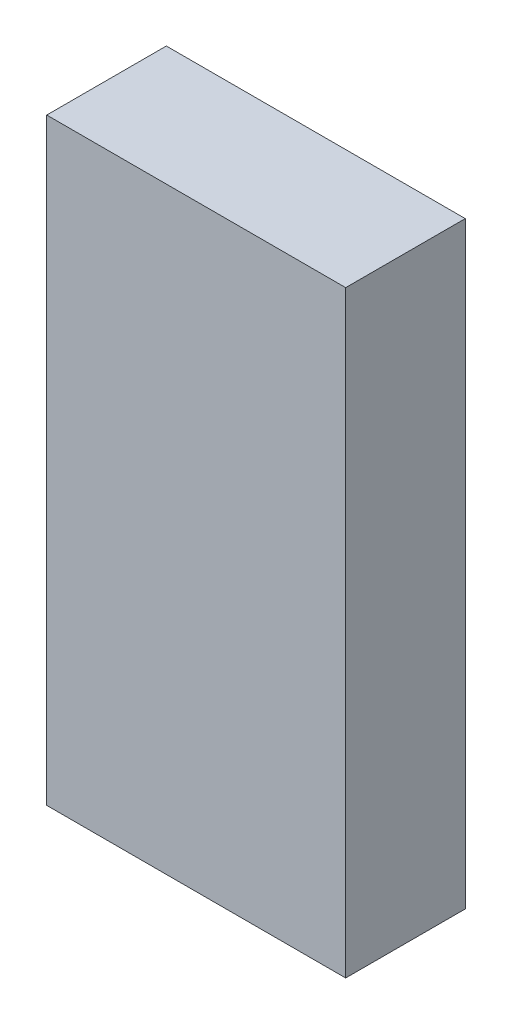
from build123d import *

# Parameters (mm, degrees)
BASEDRAWING_W       = 50
BASEDRAWING_H       = 20
BASETHICKNESS_DEPTH = 100


with BuildPart() as part:
    # BaseDrawing → BaseThickness (new body)
    with BuildSketch(Plane(origin=(0, 0, 0), x_dir=(1, 0, 0), z_dir=(0, 1, 0))):
        Rectangle(BASEDRAWING_W, BASEDRAWING_H)
    extrude(amount=BASETHICKNESS_DEPTH)


solid = part.part
